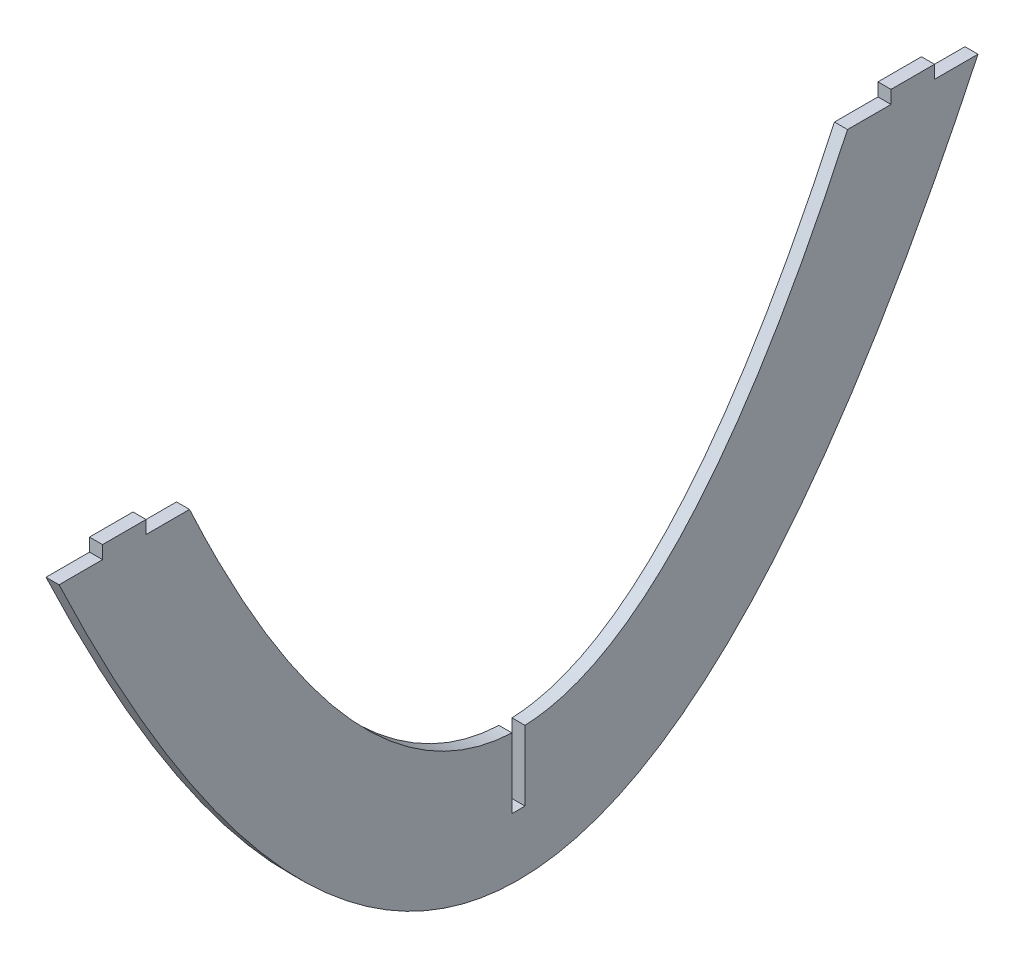
from build123d import *

# Parameters (mm, degrees)
EXTRUDE_1_DEPTH     = 3
EXTRUDE_2_DEPTH     = 3
CUT_EXTRUDE_1_DEPTH = 186.952766777


with BuildPart() as part:
    # 草图1 → 凸台-拉伸1 (new body)
    with BuildSketch(Plane(origin=(0, 0, 0), x_dir=(0, 0, -1), z_dir=(1, 0, 0))):
        with BuildLine():
            Line((-105.6416003, 150.00092714), (-75.642030641, 150.00092714))
            add(Edge.make_bspline(
                [(-75.642030641, 150.00092714), (0, -13.20202714), (75.642030641, 150.00092714)],
                knots=[0.178478001, 0.178478001, 0.178478001, 0.821521999, 0.821521999, 0.821521999], degree=2))
            Line((75.642030641, 150.00092714), (105.6416003, 150.00092714))
            add(Edge.make_bspline(
                [(-105.6416003, 150.00092714), (0, -73.20202714), (105.6416003, 150.00092714)],
                knots=[0.055246673, 0.055246673, 0.055246673, 0.944753327, 0.944753327, 0.944753327], degree=2))
        make_face()
    extrude(amount=EXTRUDE_1_DEPTH)

    # 草图2 → 凸台-拉伸2 (add)
    with BuildSketch(Plane(origin=(0, 150.00092714, 0), x_dir=(1, 0, 0), z_dir=(0, 1, 0))):
        Polygon((0, 85.641815471), (0.999992828, 85.641815471), (2.000007172, 95.641815471), (0, 95.641815471), align=None)
        Polygon((2.000007172, 95.641815471), (0.999992828, 85.641815471), (3, 85.641815471), (3, 95.641815471), align=None)
        Polygon((0, -95.641815471), (0.999992828, -95.641815471), (2.000007172, -85.641815471), (0, -85.641815471), align=None)
        Polygon((2.000007172, -85.641815471), (0.999992828, -95.641815471), (3, -95.641815471), (3, -85.641815471), align=None)
    extrude(amount=EXTRUDE_2_DEPTH)

    # 草图3 → 切除-拉伸1 (cut, through all)
    with BuildSketch(Plane.ZY):
        with BuildLine():
            Line((-1.5, 68.431538852), (-1.5, 52.367262904))
            Line((-1.5, 52.367262904), (1.5, 52.367262904))
            Line((1.5, 52.367262904), (1.5, 68.431538852))
            add(Edge.make_bspline(
                [(1.5, 68.431538852), (0, 68.367361148), (-1.5, 68.431538852)],
                knots=[0.49362414, 0.49362414, 0.49362414, 0.50637586, 0.50637586, 0.50637586], degree=2))
        make_face()
    extrude(amount=-CUT_EXTRUDE_1_DEPTH, mode=Mode.SUBTRACT)


solid = part.part
